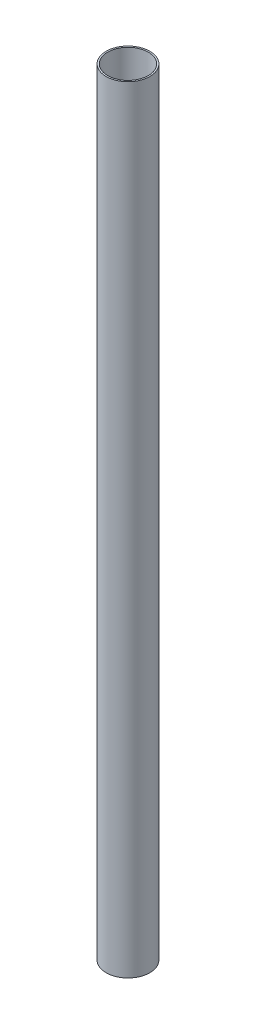
from build123d import *

# Parameters (mm, degrees)
SKETCH1_R           = 15.0495
SKETCH1_R_2         = 13.9827
BOSS_EXTRUDE1_DEPTH = 534


with BuildPart() as part:
    # Sketch1 → Boss-Extrude1 (new body)
    with BuildSketch(Plane(origin=(0, 0, 0), x_dir=(1, 0, 0), z_dir=(0, 1, 0))):
        with Locations(Location((0, 0, 0), (0, 0, 270))):
            Circle(SKETCH1_R)
        with Locations(Location((0, 0, 0), (0, 0, 270))):
            Circle(SKETCH1_R_2, mode=Mode.SUBTRACT)
    extrude(amount=BOSS_EXTRUDE1_DEPTH)


solid = part.part
